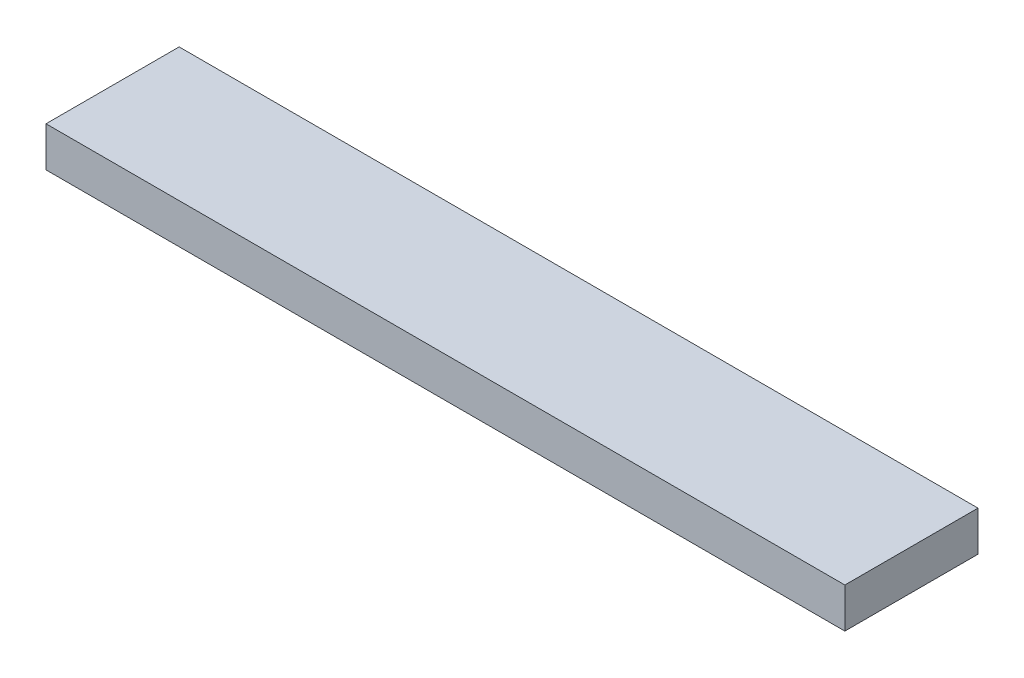
from build123d import *

# Parameters (mm, degrees)
SKETCH1_W           = 60
SKETCH1_H           = 10
BOSS_EXTRUDE1_DEPTH = 3


with BuildPart() as part:
    # Sketch1 → Boss-Extrude1 (new body)
    with BuildSketch(Plane(origin=(0, 0, 0), x_dir=(1, 0, 0), z_dir=(0, 1, 0))):
        with Locations((-30, 5)):
            Rectangle(SKETCH1_W, SKETCH1_H)
    extrude(amount=BOSS_EXTRUDE1_DEPTH)


solid = part.part
